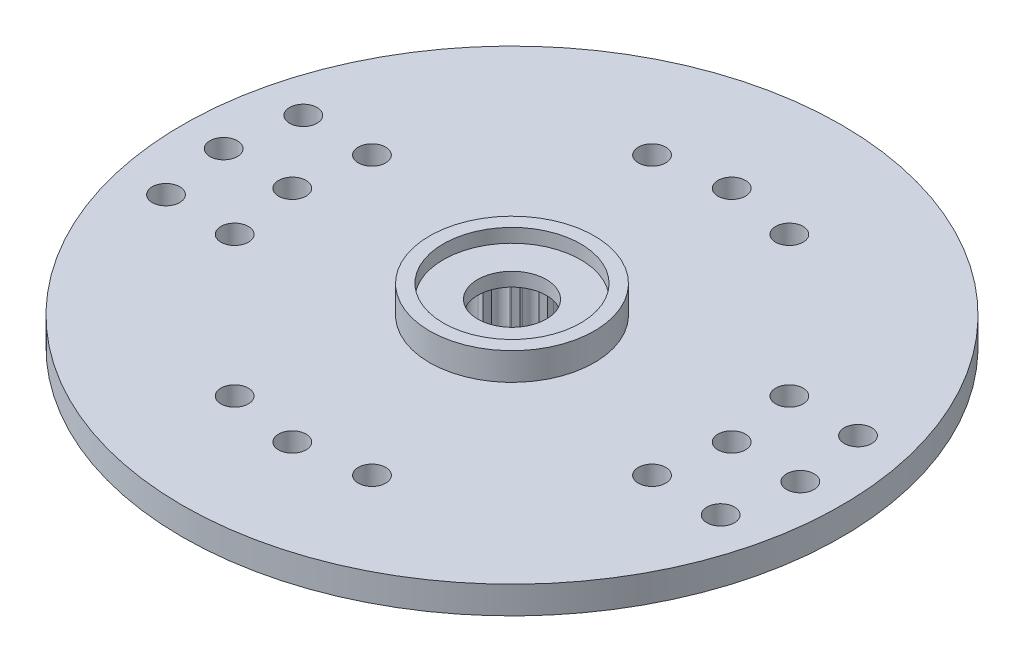
from build123d import *

# Parameters (mm, degrees)
SKETCH1_R           = 5
BOSS_EXTRUDE1_DEPTH = 2
SKETCH2_R           = 12
BOSS_EXTRUDE2_DEPTH = 2
SKETCH3_R           = 1.25
CUT_EXTRUDE1_DEPTH  = 18.435595774
CUT_EXTRUDE2_DEPTH  = 3
CUT_EXTRUDE3_START  = -1
SKETCH5_R           = 12
SKETCH5_R_2         = 3
CUT_EXTRUDE3_DEPTH  = 1
SKETCH6_R           = 2.5
CUT_EXTRUDE4_DEPTH  = 0.5
SKETCH7_R           = 0.5
CUT_EXTRUDE5_DEPTH  = 18.088007491


with BuildPart() as part:
    # Sketch1 → Boss-Extrude1 (new body)
    with BuildSketch(Plane(origin=(0, 0, 0), x_dir=(1, 0, 0), z_dir=(0, 1, 0))):
        with Locations(Location((0, 0, 0), (0, 0, 270))):
            Circle(SKETCH1_R)
    extrude(amount=BOSS_EXTRUDE1_DEPTH)

    # Sketch2 → Boss-Extrude2 (add)
    with BuildSketch(Plane(origin=(0, 2, 0), x_dir=(1, 0, 0), z_dir=(0, 1, 0))):
        with Locations(Location((0, 0, 0), (0, 0, 270))):
            Circle(SKETCH2_R)
    extrude(amount=BOSS_EXTRUDE2_DEPTH)

    # Sketch3 → Cut-Extrude1 (cut, through all)
    with BuildSketch(Plane.XZ):
        with Locations(Location((0, 0, 0), (0, 0, 270))):
            Circle(SKETCH3_R)
    extrude(amount=-CUT_EXTRUDE1_DEPTH, mode=Mode.SUBTRACT)

    # Sketch4 → Cut-Extrude2 (cut)
    with BuildSketch(Plane.XZ):
        with BuildLine():
            Line((0.25, 2.25), (0.25, 1.984313483))
            ThreePointArc((0.25, 1.984313483), (0.367499036, 1.965946199), (0.483698652, 1.940627634))
            Line((0.483698652, 1.940627634), (0.579675692, 2.188372933))
            ThreePointArc((0.579675692, 2.188372933), (0.903104165, 2.331180574), (1.045911806, 2.0077521))
            Line((1.045911806, 2.0077521), (0.949934766, 1.760006801))
            ThreePointArc((0.949934766, 1.760006801), (1.052864326, 1.700434271), (1.15207112, 1.63484927))
            Line((1.15207112, 1.63484927), (1.331062969, 1.831193975))
            ThreePointArc((1.331062969, 1.831193975), (1.684239109, 1.847522293), (1.700567428, 1.494346153))
            Line((1.700567428, 1.494346153), (1.521575579, 1.298001448))
            ThreePointArc((1.521575579, 1.298001448), (1.596034455, 1.205269273), (1.66485, 1.108275452))
            Line((1.66485, 1.108275452), (1.902682817, 1.226702123))
            ThreePointArc((1.902682817, 1.226702123), (2.237908228, 1.114345889), (2.125551994, 0.779120478))
            Line((2.125551994, 0.779120478), (1.887719178, 0.660693807))
            ThreePointArc((1.887719178, 0.660693807), (1.923651286, 0.54732598), (1.952781662, 0.432022894))
            Line((1.952781662, 0.432022894), (2.217334807, 0.456537353))
            ThreePointArc((2.217334807, 0.456537353), (2.489335441, 0.230670899), (2.263468987, -0.041329735))
            Line((2.263468987, -0.041329735), (1.998915842, -0.065844194))
            ThreePointArc((1.998915842, -0.065844194), (1.991468353, -0.184536719), (1.97697934, -0.30257675))
            Line((1.97697934, -0.30257675), (2.232523445, -0.375285317))
            ThreePointArc((2.232523445, -0.375285317), (2.404564108, -0.684157475), (2.09569195, -0.856198138))
            Line((2.09569195, -0.856198138), (1.840147845, -0.783489572))
            ThreePointArc((1.840147845, -0.783489572), (1.790326583, -0.891476712), (1.734175003, -0.996311728))
            Line((1.734175003, -0.996311728), (1.94619742, -1.156423625))
            ThreePointArc((1.94619742, -1.156423625), (1.995043068, -1.506586591), (1.644880102, -1.555432239))
            Line((1.644880102, -1.555432239), (1.432857685, -1.395320341))
            ThreePointArc((1.432857685, -1.395320341), (1.347391287, -1.478017834), (1.257160723, -1.555489285))
            Line((1.257160723, -1.555489285), (1.39702665, -1.781380515))
            ThreePointArc((1.39702665, -1.781380515), (1.316080407, -2.125542839), (0.971918083, -2.044596596))
            Line((0.971918083, -2.044596596), (0.832052155, -1.818705367))
            ThreePointArc((0.832052155, -1.818705367), (0.722483332, -1.864944459), (0.610359921, -1.904589396))
            Line((0.610359921, -1.904589396), (0.65917969, -2.165752095))
            ThreePointArc((0.65917969, -2.165752095), (0.459373795, -2.457432749), (0.16769314, -2.257626854))
            Line((0.16769314, -2.257626854), (0.118873371, -1.996464155))
            ThreePointArc((0.118873371, -1.996464155), (0, -2), (-0.118873371, -1.996464155))
            Line((-0.118873371, -1.996464155), (-0.16769314, -2.257626854))
            ThreePointArc((-0.16769314, -2.257626854), (-0.459373795, -2.457432749), (-0.65917969, -2.165752095))
            Line((-0.65917969, -2.165752095), (-0.610359921, -1.904589396))
            ThreePointArc((-0.610359921, -1.904589396), (-0.722483332, -1.864944459), (-0.832052155, -1.818705367))
            Line((-0.832052155, -1.818705367), (-0.971918083, -2.044596596))
            ThreePointArc((-0.971918083, -2.044596596), (-1.316080407, -2.125542839), (-1.39702665, -1.781380515))
            Line((-1.39702665, -1.781380515), (-1.257160723, -1.555489285))
            ThreePointArc((-1.257160723, -1.555489285), (-1.347391287, -1.478017834), (-1.432857685, -1.395320341))
            Line((-1.432857685, -1.395320341), (-1.644880102, -1.555432239))
            ThreePointArc((-1.644880102, -1.555432239), (-1.995043068, -1.506586591), (-1.94619742, -1.156423625))
            Line((-1.94619742, -1.156423625), (-1.734175003, -0.996311728))
            ThreePointArc((-1.734175003, -0.996311728), (-1.790326583, -0.891476712), (-1.840147845, -0.783489572))
            Line((-1.840147845, -0.783489572), (-2.09569195, -0.856198138))
            ThreePointArc((-2.09569195, -0.856198138), (-2.404564108, -0.684157475), (-2.232523445, -0.375285317))
            Line((-2.232523445, -0.375285317), (-1.97697934, -0.30257675))
            ThreePointArc((-1.97697934, -0.30257675), (-1.991468353, -0.184536719), (-1.998915842, -0.065844194))
            Line((-1.998915842, -0.065844194), (-2.263468987, -0.041329735))
            ThreePointArc((-2.263468987, -0.041329735), (-2.489335441, 0.230670899), (-2.217334807, 0.456537353))
            Line((-2.217334807, 0.456537353), (-1.952781662, 0.432022894))
            ThreePointArc((-1.952781662, 0.432022894), (-1.923651286, 0.54732598), (-1.887719178, 0.660693807))
            Line((-1.887719178, 0.660693807), (-2.125551994, 0.779120478))
            ThreePointArc((-2.125551994, 0.779120478), (-2.237908228, 1.114345889), (-1.902682817, 1.226702123))
            Line((-1.902682817, 1.226702123), (-1.66485, 1.108275452))
            ThreePointArc((-1.66485, 1.108275452), (-1.596034455, 1.205269273), (-1.521575579, 1.298001448))
            Line((-1.521575579, 1.298001448), (-1.700567428, 1.494346153))
            ThreePointArc((-1.700567428, 1.494346153), (-1.684239109, 1.847522293), (-1.331062969, 1.831193975))
            Line((-1.331062969, 1.831193975), (-1.15207112, 1.63484927))
            ThreePointArc((-1.15207112, 1.63484927), (-1.052864326, 1.700434271), (-0.949934766, 1.760006801))
            Line((-0.949934766, 1.760006801), (-1.045911806, 2.0077521))
            ThreePointArc((-1.045911806, 2.0077521), (-0.903104165, 2.331180574), (-0.579675692, 2.188372933))
            Line((-0.579675692, 2.188372933), (-0.483698652, 1.940627634))
            ThreePointArc((-0.483698652, 1.940627634), (-0.367499036, 1.965946199), (-0.25, 1.984313483))
            Line((-0.25, 1.984313483), (-0.25, 2.25))
            ThreePointArc((-0.25, 2.25), (0, 2.5), (0.25, 2.25))
        make_face()
    extrude(amount=-CUT_EXTRUDE2_DEPTH, mode=Mode.SUBTRACT)

    # Sketch5 → Cut-Extrude3 (cut)
    with BuildSketch(Plane(origin=(0, 4, 0), x_dir=(1, 0, 0), z_dir=(0, 1, 0)).offset(CUT_EXTRUDE3_START)):
        with Locations(Location((0, 0, 0), (0, 0, 270))):
            Circle(SKETCH5_R)
        with Locations(Location((0, 0, 0), (0, 0, 270))):
            Circle(SKETCH5_R_2, mode=Mode.SUBTRACT)
    extrude(amount=CUT_EXTRUDE3_DEPTH, mode=Mode.SUBTRACT)

    # Sketch6 → Cut-Extrude4 (cut)
    with BuildSketch(Plane(origin=(0, 4, 0), x_dir=(1, 0, 0), z_dir=(0, 1, 0))):
        with Locations(Location((0, 0, 0), (0, 0, 270))):
            Circle(SKETCH6_R)
    extrude(amount=-CUT_EXTRUDE4_DEPTH, mode=Mode.SUBTRACT)

    # Sketch7 → Cut-Extrude5 (cut, through all)
    with BuildSketch(Plane.XZ.offset(-2)):
        with Locations(Location((0, 8, 0), (0, 0, 270))):
            Circle(SKETCH7_R)
        with Locations(Location((2.5, 7.599342077, 0), (0, 0, 270))):
            Circle(SKETCH7_R)
        with Locations(Location((-2.5, 7.599342077, 0), (0, 0, 270))):
            Circle(SKETCH7_R)
        with Locations(Location((8, 0, 0), (0, 0, 270))):
            Circle(SKETCH7_R)
        with Locations(Location((7.599342077, -2.5, 0), (0, 0, 270))):
            Circle(SKETCH7_R)
        with Locations(Location((7.599342077, 2.5, 0), (0, 0, 270))):
            Circle(SKETCH7_R)
        with Locations(Location((0, -8, 0), (0, 0, 270))):
            Circle(SKETCH7_R)
        with Locations(Location((-2.5, -7.599342077, 0), (0, 0, 270))):
            Circle(SKETCH7_R)
        with Locations(Location((2.5, -7.599342077, 0), (0, 0, 270))):
            Circle(SKETCH7_R)
        with Locations(Location((-8, 0, 0), (0, 0, 270))):
            Circle(SKETCH7_R)
        with Locations(Location((-7.599342077, 2.5, 0), (0, 0, 270))):
            Circle(SKETCH7_R)
        with Locations(Location((-7.599342077, -2.5, 0), (0, 0, 270))):
            Circle(SKETCH7_R)
        with Locations(Location((10.099342077, 2.5, 0), (0, 0, 270))):
            Circle(SKETCH7_R)
        with Locations(Location((10.099342077, -2.5, 0), (0, 0, 270))):
            Circle(SKETCH7_R)
        with Locations(Location((10.5, 0, 0), (0, 0, 270))):
            Circle(SKETCH7_R)
        with Locations(Location((-10.099342077, 2.5, 0), (0, 0, 270))):
            Circle(SKETCH7_R)
        with Locations(Location((-10.099342077, -2.5, 0), (0, 0, 270))):
            Circle(SKETCH7_R)
        with Locations(Location((-10.5, 0, 0), (0, 0, 270))):
            Circle(SKETCH7_R)
    extrude(amount=-CUT_EXTRUDE5_DEPTH, mode=Mode.SUBTRACT)


solid = part.part
